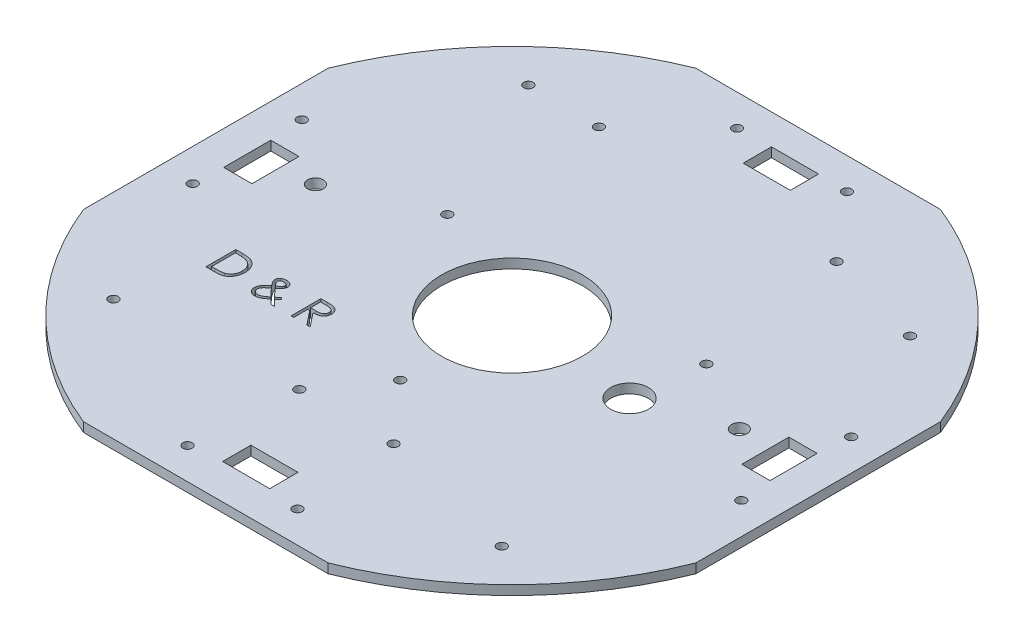
from build123d import *

# Parameters (mm, degrees)
SKETCH1_W                       = 195
SKETCH1_H                       = 195
PLATE_DEPTH                     = 3
SKETCH2_R                       = 177.836364648
SKETCH2_R_2                     = 105
OUTLINE_DEPTH                   = 30
SKETCH6_R                       = 22.448904698
MIDDLE_CIRCLE_DEPTH             = 145
PING_SENSOR_AND_ARDUINO_HOLES_R = 1.5
PING_AND_ARDUINO_DEPTH          = 30
STANDS_R                        = 1.5
STAND_DEPTH                     = 30
SKETCH8_R                       = 2.5
HANDLES_DEPTH                   = 30
SKETCH9_R                       = 1.5
COMPASS_DEPTH                   = 10
SKETCH10_R                      = 6
POWER_SUPPLY_DEPTH              = 10
CUT_EXTRUDE5_DEPTH              = 10
SKETCH14_W                      = 9
SKETCH14_H                      = 15
SKETCH14_W_2                    = 15
SKETCH14_H_2                    = 9
CUT_EXTRUDE6_DEPTH              = 10
SKETCH15_R                      = 1.5
CUT_EXTRUDE7_DEPTH              = 10


with BuildPart() as part:
    # Sketch1 → Plate (new body)
    with BuildSketch(Plane(origin=(0, 0, 0), x_dir=(1, 0, 0), z_dir=(0, 1, 0))):
        Rectangle(SKETCH1_W, SKETCH1_H)
    extrude(amount=PLATE_DEPTH)

    # Sketch2 → Outline (cut)
    with BuildSketch(Plane(origin=(0, 0, 0), x_dir=(1, 0, 0), z_dir=(0, 1, 0))):
        Circle(SKETCH2_R)
        Circle(SKETCH2_R_2, mode=Mode.SUBTRACT)
    extrude(amount=OUTLINE_DEPTH, mode=Mode.SUBTRACT)

    # Sketch6 → Middle Circle (cut)
    with BuildSketch(Plane(origin=(0, 0, 0), x_dir=(1, 0, 0), z_dir=(0, 1, 0))):
        with Locations(Location((0, 0, 0), (0, 0, 90))):
            Circle(SKETCH6_R)
    extrude(amount=MIDDLE_CIRCLE_DEPTH, mode=Mode.SUBTRACT)

    # Ping Sensor and Arduino Holes → Ping and Arduino (cut)
    with BuildSketch(Plane(origin=(0, 3, 0), x_dir=(1, 0, 0), z_dir=(0, 1, 0))):
        with Locations(Location((87.479634807, 20.549979122, 0), (0, 0, 270))):
            Circle(PING_SENSOR_AND_ARDUINO_HOLES_R)
        with Locations(Location((87.5, -14.450014953, 0), (0, 0, 270))):
            Circle(PING_SENSOR_AND_ARDUINO_HOLES_R)
        with Locations(Location((19.177133287, -87.5, 0), (0, 0, 270))):
            Circle(PING_SENSOR_AND_ARDUINO_HOLES_R)
        with Locations(Location((-15.822866713, -87.5, 0), (0, 0, 270))):
            Circle(PING_SENSOR_AND_ARDUINO_HOLES_R)
        with Locations(Location((-87.5, 20.549979122, 0), (0, 0, 270))):
            Circle(PING_SENSOR_AND_ARDUINO_HOLES_R)
        with Locations(Location((-87.240743574, -14.449060666, 0), (0, 0, 270))):
            Circle(PING_SENSOR_AND_ARDUINO_HOLES_R)
        with Locations(Location((-15.822866713, 87.5, 0), (0, 0, 270))):
            Circle(PING_SENSOR_AND_ARDUINO_HOLES_R)
        with Locations(Location((19.177133287, 87.5, 0), (0, 0, 270))):
            Circle(PING_SENSOR_AND_ARDUINO_HOLES_R)
        with Locations(Location((-38.186966972, 17.586762855, 0), (0, 0, 270))):
            Circle(PING_SENSOR_AND_ARDUINO_HOLES_R)
        with Locations(Location((44.313033028, 17.586762855, 0), (0, 0, 270))):
            Circle(PING_SENSOR_AND_ARDUINO_HOLES_R)
        with Locations(Location((-38.201988835, 65.886760519, 0), (0, 0, 270))):
            Circle(PING_SENSOR_AND_ARDUINO_HOLES_R)
        with Locations(Location((36.794744406, 66.586762855, 0), (0, 0, 270))):
            Circle(PING_SENSOR_AND_ARDUINO_HOLES_R)
    extrude(amount=-PING_AND_ARDUINO_DEPTH, mode=Mode.SUBTRACT)

    # Stands → Stand (cut)
    with BuildSketch(Plane(origin=(0, 3, 0), x_dir=(1, 0, 0), z_dir=(0, 1, 0))):
        with Locations(Location((61.994866731, -65.242903821, 0), (0, 0, 270))):
            Circle(STANDS_R)
        with Locations(Location((-68.005133269, -58.951690807, 0), (0, 0, 270))):
            Circle(STANDS_R)
        with Locations(Location((-60.977410647, 66.194829034, 0), (0, 0, 270))):
            Circle(STANDS_R)
        with Locations(Location((69.022589353, 57.757096179, 0), (0, 0, 270))):
            Circle(STANDS_R)
    extrude(amount=-STAND_DEPTH, mode=Mode.SUBTRACT)

    # Sketch8 → Handles (cut)
    with BuildSketch(Plane(origin=(0, 3, 0), x_dir=(1, 0, 0), z_dir=(0, 1, 0))):
        with Locations(Location((-67.5, 4.903874145, 0), (0, 0, 270))):
            Circle(SKETCH8_R)
        with Locations(Location((67.5, 4.903874145, 0), (0, 0, 270))):
            Circle(SKETCH8_R)
    extrude(amount=-HANDLES_DEPTH, mode=Mode.SUBTRACT)

    # Sketch9 → Compass (cut)
    with BuildSketch(Plane(origin=(0, 3, 0), x_dir=(1, 0, 0), z_dir=(0, 1, 0))):
        with Locations(Location((0, -35.600679942, 0), (0, 0, 270))):
            Circle(SKETCH9_R)
    extrude(amount=-COMPASS_DEPTH, mode=Mode.SUBTRACT)

    # Sketch10 → Power Supply (cut)
    with BuildSketch(Plane(origin=(0, 3, 0), x_dir=(1, 0, 0), z_dir=(0, 1, 0))):
        with Locations(Location((41.559592035, -4.12540068, 0), (0, 0, 270))):
            Circle(SKETCH10_R)
    extrude(amount=-POWER_SUPPLY_DEPTH, mode=Mode.SUBTRACT)

    # Sketch13 → Cut-Extrude5 (cut)
    # profile 1 of 3: a face of its own
    with BuildSketch(Plane(origin=(0, 3, 0), x_dir=(1, 0, 0), z_dir=(0, 1, 0))):
        with BuildLine():
            Line((-62.201246871, -35.295094706), (-62.201246871, -25.770094706))
            Line((-62.201246871, -25.770094706), (-60.277929563, -25.770094706))
            add(Edge.make_bspline(
                [(-60.277929563, -25.770094706), (-60.110646103, -25.771299129), (-59.787455327, -25.773626067), (-59.320424309, -25.788379996), (-58.888305642, -25.814479764), (-58.492520504, -25.852496831), (-58.131982348, -25.899177587), (-57.807700707, -25.957689402), (-57.517998804, -26.026781494), (-57.339828398, -26.085688041), (-57.255573794, -26.113544225)],
                knots=[0, 0, 0, 0, 1.314313732, 2.53924729, 3.670748893, 4.714932338, 5.66265055, 6.526160246, 7.303039223, 8, 8, 8, 8], degree=3))
            add(Edge.make_bspline(
                [(-57.255573794, -26.113544225), (-57.145370254, -26.155537789), (-56.927462223, -26.23857264), (-56.617199983, -26.395208003), (-56.325121673, -26.572680802), (-56.049661001, -26.771224971), (-55.79711018, -26.996462233), (-55.557602975, -27.238824731), (-55.340937191, -27.507125857), (-55.142522471, -27.79580136), (-54.96362757, -28.101450587), (-54.808127433, -28.423491133), (-54.67898478, -28.760287535), (-54.571778927, -29.110903188), (-54.487288211, -29.476109045), (-54.429643096, -29.856330352), (-54.391622045, -30.250064431), (-54.38780102, -30.517239222), (-54.385862256, -30.652802038)],
                knots=[0, 0, 0, 0, 0.984719456, 1.947108742, 2.898477687, 3.838006223, 4.779231079, 5.722358779, 6.681677486, 7.655904652, 8.64651281, 9.637519902, 10.640069247, 11.656948941, 12.698408672, 13.768548281, 14.867775369, 16, 16, 16, 16], degree=3))
            add(Edge.make_bspline(
                [(-54.385862256, -30.652802038), (-54.387573946, -30.770534408), (-54.39094701, -31.002538341), (-54.421234648, -31.344461064), (-54.465257348, -31.67624014), (-54.533413343, -31.996295653), (-54.616151612, -32.307431731), (-54.722189766, -32.606332339), (-54.843662081, -32.89573942), (-54.985312108, -33.171739837), (-55.140818305, -33.433223872), (-55.307701049, -33.679718702), (-55.485782342, -33.907706984), (-55.676760314, -34.117879135), (-55.878167028, -34.309918316), (-56.091321099, -34.48542873), (-56.316772545, -34.640976211), (-56.553511583, -34.782673127), (-56.808444478, -34.90628138), (-57.086399942, -35.010865907), (-57.388563362, -35.097534196), (-57.714193059, -35.169844991), (-58.063851666, -35.227205365), (-58.437881995, -35.265649333), (-58.835709376, -35.291646956), (-59.108884376, -35.293923141), (-59.249489059, -35.295094706)],
                knots=[0, 0, 0, 0, 1.105936401, 2.179363191, 3.223086493, 4.248585256, 5.251745608, 6.245858792, 7.225916811, 8.198733463, 9.158002045, 10.082870192, 10.993790845, 11.873723703, 12.748670949, 13.606408763, 14.465103618, 15.319838547, 16.196477973, 17.123216899, 18.106603292, 19.147568657, 20.255746949, 21.433717677, 22.679120308, 24, 24, 24, 24], degree=3))
            Line((-59.249489059, -35.295094706), (-62.201246871, -35.295094706))
        make_face()
        with BuildLine():
            Line((-61.346439179, -34.318171629), (-60.253124876, -34.318171629))
            add(Edge.make_bspline(
                [(-60.253124876, -34.318171629), (-60.096021238, -34.317496453), (-59.793853408, -34.316197841), (-59.359355573, -34.304802667), (-58.962355215, -34.286182822), (-58.602795965, -34.260124932), (-58.280880834, -34.225648201), (-57.995937058, -34.187208287), (-57.748898676, -34.139318082), (-57.599412137, -34.095908685), (-57.53033341, -34.075848913)],
                knots=[0, 0, 0, 0, 1.375205317, 2.645023457, 3.804390687, 4.853969522, 5.800190428, 6.637939096, 7.370582563, 8, 8, 8, 8], degree=3))
            add(Edge.make_bspline(
                [(-57.53033341, -34.075848913), (-57.443388224, -34.045228601), (-57.271574537, -33.984719342), (-57.024248156, -33.874344564), (-56.793588021, -33.743601503), (-56.57557431, -33.598271029), (-56.373299626, -33.433227266), (-56.184366852, -33.252059075), (-56.009156379, -33.053844437), (-55.849478441, -32.838829369), (-55.706580842, -32.60835214), (-55.582834139, -32.364678599), (-55.474381042, -32.110478637), (-55.389258587, -31.841848713), (-55.322541175, -31.561190346), (-55.275284417, -31.268483795), (-55.245852917, -30.96378372), (-55.242419977, -30.756541154), (-55.240669948, -30.650893985)],
                knots=[0, 0, 0, 0, 0.998632004, 1.973411704, 2.929992603, 3.868527914, 4.809262121, 5.754881198, 6.702106254, 7.672490631, 8.653608572, 9.636854334, 10.631411391, 11.644891563, 12.686317036, 13.754757253, 14.855430412, 16, 16, 16, 16], degree=3))
            add(Edge.make_bspline(
                [(-55.240669948, -30.650893985), (-55.242066823, -30.539496442), (-55.244810996, -30.320654983), (-55.279303227, -29.999551734), (-55.329708317, -29.690722249), (-55.402598205, -29.394145875), (-55.495482954, -29.109244002), (-55.611401229, -28.837592335), (-55.743843957, -28.576321942), (-55.901423753, -28.331463132), (-56.07400476, -28.099888314), (-56.265533132, -27.887739579), (-56.472965965, -27.694533662), (-56.694040806, -27.517261676), (-56.934988197, -27.363055529), (-57.19013217, -27.225115347), (-57.463215747, -27.108050671), (-57.653206012, -27.04578748), (-57.749759491, -27.014145187)],
                knots=[0, 0, 0, 0, 1.122418816, 2.205001699, 3.251619955, 4.274784885, 5.280384055, 6.268708349, 7.249350384, 8.229342522, 9.199999885, 10.157847722, 11.105861043, 12.055065948, 13.010012805, 13.98527497, 14.976112212, 16, 16, 16, 16], degree=3))
            add(Edge.make_bspline(
                [(-57.749759491, -27.014145187), (-57.82963654, -26.992056908), (-57.99947706, -26.945091167), (-58.276625887, -26.893859261), (-58.58854283, -26.848671303), (-58.936612731, -26.810413353), (-59.320438823, -26.782961428), (-59.740316302, -26.762356636), (-60.196426655, -26.748459301), (-60.512609122, -26.747510319), (-60.676712616, -26.747017783)],
                knots=[0, 0, 0, 0, 0.674548936, 1.434276114, 2.292660221, 3.240891867, 4.284742987, 5.42552168, 6.663806718, 8, 8, 8, 8], degree=3))
            Line((-60.676712616, -26.747017783), (-61.346439179, -26.747017783))
            Line((-61.346439179, -26.747017783), (-61.346439179, -34.318171629))
        make_face(mode=Mode.SUBTRACT)
    # profile 2 of 3: a face of its own
    with BuildSketch(Plane(origin=(0, 3, 0), x_dir=(1, 0, 0), z_dir=(0, 1, 0))):
        with BuildLine():
            Line((-41.66868978, -31.753748552), (-41.128710813, -32.379589898))
            add(Edge.make_bspline(
                [(-41.128710813, -32.379589898), (-41.230492582, -32.462248875), (-41.4308949, -32.62499954), (-41.725043756, -32.864545029), (-42.008838915, -33.093839972), (-42.192845781, -33.244478657), (-42.283082809, -33.318351918)],
                knots=[0, 0, 0, 0, 1.057475972, 2.082108015, 3.059465138, 4, 4, 4, 4], degree=3))
            add(Edge.make_bspline(
                [(-42.283082809, -33.318351918), (-42.203491251, -33.399038444), (-42.037673015, -33.567137897), (-41.780813785, -33.831152551), (-41.501460174, -34.112790752), (-41.309861113, -34.30851856), (-41.210757087, -34.409758168)],
                knots=[0, 0, 0, 0, 0.888881212, 1.851863672, 2.888883089, 4, 4, 4, 4], degree=3))
            add(Edge.make_bspline(
                [(-41.210757087, -34.409758168), (-41.131874656, -34.489880463), (-40.978526918, -34.645638501), (-40.754769042, -34.873450459), (-40.543534505, -35.087728455), (-40.408009995, -35.227586137), (-40.342593025, -35.295094706)],
                knots=[0, 0, 0, 0, 1.088118532, 2.115306442, 3.090268309, 4, 4, 4, 4], degree=3))
            Line((-40.342593025, -35.295094706), (-41.491240862, -35.295094706))
            Line((-41.491240862, -35.295094706), (-42.922280525, -33.837342302))
            add(Edge.make_bspline(
                [(-42.922280525, -33.837342302), (-43.024292807, -33.919879419), (-43.221152187, -34.079156375), (-43.512580202, -34.301942571), (-43.784069983, -34.506741352), (-44.039652862, -34.688391423), (-44.279452564, -34.847252901), (-44.500867273, -34.986422561), (-44.706184108, -35.104144193), (-44.955792648, -35.231000741), (-45.263951329, -35.354236668), (-45.639391358, -35.462609574), (-46.026342594, -35.527411417), (-46.287844727, -35.535330991), (-46.419741462, -35.539325475)],
                knots=[0, 0, 0, 0, 1.188070381, 2.29269255, 3.321212884, 4.267145447, 5.131232476, 5.925402657, 6.634692834, 7.273399376, 8.459346405, 9.633235643, 10.80624877, 12, 12, 12, 12], degree=3))
            add(Edge.make_bspline(
                [(-46.419741462, -35.539325475), (-46.506344363, -35.537777028), (-46.675666215, -35.534749577), (-46.922606703, -35.502819411), (-47.156788135, -35.454394351), (-47.377146467, -35.383232576), (-47.584609754, -35.292746336), (-47.780362819, -35.184875008), (-47.961107285, -35.052852108), (-48.12798112, -34.903244369), (-48.277260457, -34.738166553), (-48.409000371, -34.56295672), (-48.520141662, -34.376781851), (-48.61156743, -34.180524484), (-48.683091213, -33.974734386), (-48.731973293, -33.759033902), (-48.763842289, -33.53364438), (-48.766966511, -33.379520904), (-48.768554563, -33.301179442)],
                knots=[0, 0, 0, 0, 1.140827302, 2.230491023, 3.276155818, 4.288841946, 5.276195931, 6.25568983, 7.228235982, 8.219567526, 9.204677076, 10.15696153, 11.104363201, 12.056942777, 13.006011855, 13.969848463, 14.968067402, 16, 16, 16, 16], degree=3))
            add(Edge.make_bspline(
                [(-48.768554563, -33.301179442), (-48.762654978, -33.179907331), (-48.750755556, -32.935302384), (-48.664595526, -32.569188973), (-48.52215275, -32.205851277), (-48.363347041, -31.902293408), (-48.196352296, -31.657721443), (-48.044469312, -31.456440636), (-47.858050465, -31.247486338), (-47.648109118, -31.022221227), (-47.405537737, -30.788098472), (-47.136951654, -30.540044698), (-46.839049595, -30.280581097), (-46.628164546, -30.107202491), (-46.518960212, -30.017420427)],
                knots=[0, 0, 0, 0, 1.059627018, 2.137259838, 3.268884587, 4.465199172, 5.122089581, 5.855989104, 6.667703162, 7.568389345, 8.547351898, 9.613609101, 10.764235646, 12, 12, 12, 12], degree=3))
            add(Edge.make_bspline(
                [(-46.518960212, -30.017420427), (-46.577719411, -29.943197708), (-46.690565463, -29.800654224), (-46.848934084, -29.592627738), (-46.991000597, -29.399388975), (-47.115832299, -29.220490779), (-47.227361027, -29.058656089), (-47.322020681, -28.911636225), (-47.397362353, -28.778272483), (-47.479363278, -28.625009594), (-47.55479793, -28.443249935), (-47.620893129, -28.230688304), (-47.660986407, -28.022467481), (-47.666704676, -27.885014936), (-47.669516102, -27.817435451)],
                knots=[0, 0, 0, 0, 1.347531222, 2.587911062, 3.721495934, 4.761363145, 5.693007242, 6.519321152, 7.249247836, 7.872897469, 8.99276919, 10.043809027, 11.038225309, 12, 12, 12, 12], degree=3))
            add(Edge.make_bspline(
                [(-47.669516102, -27.817435451), (-47.668462112, -27.760703807), (-47.66638897, -27.649115625), (-47.637744052, -27.486242889), (-47.596112811, -27.329990468), (-47.537492929, -27.180859016), (-47.458995742, -27.040779285), (-47.368466963, -26.905605257), (-47.255754867, -26.781673532), (-47.172149141, -26.705634825), (-47.129537136, -26.666879562)],
                knots=[0, 0, 0, 0, 1.03459038, 2.034985263, 3.00970721, 3.984429156, 4.951093115, 5.936753036, 6.948408246, 8, 8, 8, 8], degree=3))
            add(Edge.make_bspline(
                [(-47.129537136, -26.666879562), (-47.076807776, -26.624624429), (-46.971609115, -26.540322562), (-46.801321005, -26.430226494), (-46.61842602, -26.342662211), (-46.429822558, -26.263762474), (-46.22953673, -26.208031348), (-46.021179816, -26.165450169), (-45.802787992, -26.140252809), (-45.654040661, -26.137727096), (-45.57829014, -26.13644086)],
                knots=[0, 0, 0, 0, 0.967861857, 1.93095028, 2.896793832, 3.869789818, 4.856135748, 5.869432465, 6.914994986, 8, 8, 8, 8], degree=3))
            add(Edge.make_bspline(
                [(-45.57829014, -26.13644086), (-45.482725486, -26.139470787), (-45.29438776, -26.145442131), (-45.018830376, -26.189711188), (-44.756086168, -26.264554068), (-44.510508565, -26.369704762), (-44.28246727, -26.495410691), (-44.083150052, -26.647605084), (-43.91025709, -26.818475594), (-43.769866718, -27.010332205), (-43.657439924, -27.21299974), (-43.575636461, -27.423941725), (-43.525938099, -27.641479886), (-43.520379054, -27.789197183), (-43.517593025, -27.863228721)],
                knots=[0, 0, 0, 0, 1.150236937, 2.266873792, 3.350248666, 4.431131026, 5.476858895, 6.476929332, 7.440723444, 8.393319161, 9.328959997, 10.223430523, 11.109635963, 12, 12, 12, 12], degree=3))
            add(Edge.make_bspline(
                [(-43.517593025, -27.863228721), (-43.521620237, -27.94380509), (-43.529964913, -28.110765208), (-43.602436865, -28.361715989), (-43.712862015, -28.620673763), (-43.840845332, -28.838631646), (-43.969981351, -29.019568583), (-44.090066619, -29.167723111), (-44.230609139, -29.325153758), (-44.394500493, -29.491637755), (-44.578507933, -29.66775408), (-44.783764716, -29.853831838), (-45.01081885, -30.047862292), (-45.17097574, -30.178651114), (-45.25392115, -30.246386773)],
                knots=[0, 0, 0, 0, 0.95228837, 1.973211012, 3.069609294, 4.280899273, 4.9557195, 5.700045445, 6.53727831, 7.453060125, 8.46483533, 9.552225843, 10.73229536, 12, 12, 12, 12], degree=3))
            Line((-45.25392115, -30.246386773), (-43.819065381, -31.753748552))
            Line((-43.819065381, -31.753748552), (-42.865038938, -32.726855523))
            add(Edge.make_bspline(
                [(-42.865038938, -32.726855523), (-42.749950881, -32.633322721), (-42.529950016, -32.454526607), (-42.215106545, -32.199646179), (-41.932482342, -31.96749584), (-41.753352551, -31.822349568), (-41.66868978, -31.753748552)],
                knots=[0, 0, 0, 0, 1.154001856, 2.20597526, 3.152083497, 4, 4, 4, 4], degree=3))
        make_face()
        with BuildLine():
            add(Edge.make_bspline(
                [(-45.839693386, -29.538499153), (-45.714992294, -29.454416717), (-45.476909529, -29.293884209), (-45.156709055, -29.036259281), (-44.878321758, -28.787304952), (-44.725528842, -28.607157055), (-44.652884491, -28.521506966)],
                knots=[0, 0, 0, 0, 1.149778042, 2.195187973, 3.141914424, 4, 4, 4, 4], degree=3))
            add(Edge.make_bspline(
                [(-44.652884491, -28.521506966), (-44.610486819, -28.465329362), (-44.530646269, -28.359539337), (-44.443891199, -28.195231947), (-44.383111106, -28.041664944), (-44.375845041, -27.940028237), (-44.372400717, -27.891849514)],
                knots=[0, 0, 0, 0, 1.202613574, 2.264683996, 3.177410281, 4, 4, 4, 4], degree=3))
            add(Edge.make_bspline(
                [(-44.372400717, -27.891849514), (-44.376448711, -27.840321669), (-44.384604166, -27.736509014), (-44.452723532, -27.588163249), (-44.564102952, -27.454886083), (-44.713971468, -27.33627932), (-44.896545375, -27.235572922), (-45.110102845, -27.162895139), (-45.351588026, -27.122087976), (-45.521525745, -27.116366941), (-45.610727039, -27.113363937)],
                knots=[0, 0, 0, 0, 0.764515178, 1.54026142, 2.381579227, 3.330821025, 4.368998387, 5.470797668, 6.672407028, 8, 8, 8, 8], degree=3))
            add(Edge.make_bspline(
                [(-45.610727039, -27.113363937), (-45.69549784, -27.116270787), (-45.858630223, -27.12186471), (-46.0913243, -27.164940834), (-46.299304465, -27.240368872), (-46.479679784, -27.341876383), (-46.62687402, -27.463853926), (-46.734793006, -27.601246249), (-46.802610681, -27.751858451), (-46.810692643, -27.858127213), (-46.81470841, -27.910930043)],
                knots=[0, 0, 0, 0, 1.27617104, 2.455855338, 3.546649981, 4.593280411, 5.55842324, 6.40519289, 7.207572142, 8, 8, 8, 8], degree=3))
            add(Edge.make_bspline(
                [(-46.81470841, -27.910930043), (-46.813184194, -27.951725793), (-46.810135578, -28.033322254), (-46.787269772, -28.153734084), (-46.746339659, -28.269339889), (-46.709317162, -28.341890628), (-46.690684972, -28.378402999)],
                knots=[0, 0, 0, 0, 1.001046439, 2.002214593, 2.994581098, 4, 4, 4, 4], degree=3))
            add(Edge.make_bspline(
                [(-46.690684972, -28.378402999), (-46.636508453, -28.469463359), (-46.523219143, -28.659881011), (-46.322662848, -28.941875939), (-46.09561124, -29.239676168), (-45.927220914, -29.436297463), (-45.839693386, -29.538499153)],
                knots=[0, 0, 0, 0, 0.882093017, 1.844557613, 2.879623611, 4, 4, 4, 4], degree=3))
        make_face(mode=Mode.SUBTRACT)
        with BuildLine():
            add(Edge.make_bspline(
                [(-45.895026919, -30.732940259), (-45.994618374, -30.80878663), (-46.186354866, -30.954808367), (-46.456542231, -31.172741393), (-46.702521344, -31.376265287), (-46.91918898, -31.570820016), (-47.110331674, -31.751885328), (-47.27636222, -31.919574217), (-47.413415181, -32.077490121), (-47.558273806, -32.265858045), (-47.696582129, -32.491845052), (-47.819259829, -32.756381914), (-47.897427048, -33.012485152), (-47.908454222, -33.181768456), (-47.913746871, -33.263018384)],
                knots=[0, 0, 0, 0, 1.348995177, 2.597126469, 3.74061818, 4.789100084, 5.734499531, 6.577865258, 7.330979068, 7.986257854, 9.13712093, 10.176896549, 11.124975592, 12, 12, 12, 12], degree=3))
            add(Edge.make_bspline(
                [(-47.913746871, -33.263018384), (-47.912086487, -33.308874961), (-47.908771797, -33.400420255), (-47.888084103, -33.535735977), (-47.85079619, -33.66648549), (-47.801360848, -33.79357936), (-47.735685088, -33.916252922), (-47.655566003, -34.034424549), (-47.560225806, -34.147434445), (-47.455232332, -34.257409905), (-47.338323301, -34.358163152), (-47.210958279, -34.443560853), (-47.079402119, -34.518559883), (-46.941225946, -34.580950253), (-46.795211138, -34.625184312), (-46.644461187, -34.66101413), (-46.48632638, -34.679261472), (-46.379073313, -34.682741711), (-46.324338818, -34.684517783)],
                knots=[0, 0, 0, 0, 0.93114453, 1.858880562, 2.770572272, 3.686551743, 4.622340414, 5.589324723, 6.57965016, 7.620701392, 8.673933733, 9.705411322, 10.728856044, 11.746254978, 12.775385999, 13.821629539, 14.888311458, 16, 16, 16, 16], degree=3))
            add(Edge.make_bspline(
                [(-46.324338818, -34.684517783), (-46.24019261, -34.682129978), (-46.071487051, -34.677342644), (-45.821008572, -34.632662319), (-45.572060182, -34.565332656), (-45.412874152, -34.497554022), (-45.332151318, -34.463183648)],
                knots=[0, 0, 0, 0, 0.985107723, 1.975052154, 2.97315407, 4, 4, 4, 4], degree=3))
            add(Edge.make_bspline(
                [(-45.332151318, -34.463183648), (-45.266242714, -34.432159424), (-45.12999656, -34.3680262), (-44.926077714, -34.252813046), (-44.71026854, -34.126554447), (-44.487512403, -33.980094099), (-44.254648795, -33.819828368), (-44.01185263, -33.644126097), (-43.760489759, -33.451246327), (-43.591120643, -33.315488021), (-43.504236655, -33.245845908)],
                knots=[0, 0, 0, 0, 0.793866152, 1.641078755, 2.55195156, 3.519315084, 4.546339611, 5.633686856, 6.786114446, 8, 8, 8, 8], degree=3))
            Line((-43.504236655, -33.245845908), (-45.032587015, -31.686966701))
            add(Edge.make_bspline(
                [(-45.032587015, -31.686966701), (-45.098996971, -31.61661251), (-45.236802039, -31.47062289), (-45.445062767, -31.239512313), (-45.66788144, -30.993418028), (-45.817714752, -30.821597541), (-45.895026919, -30.732940259)],
                knots=[0, 0, 0, 0, 0.902632658, 1.873022723, 2.90250559, 4, 4, 4, 4], degree=3))
        make_face(mode=Mode.SUBTRACT)
    # profile 3 of 3: a face of its own
    with BuildSketch(Plane(origin=(0, 3, 0), x_dir=(1, 0, 0), z_dir=(0, 1, 0))):
        with BuildLine():
            Line((-35.091631487, -25.770094706), (-33.185486655, -25.770094706))
            add(Edge.make_bspline(
                [(-33.185486655, -25.770094706), (-33.058284012, -25.770518122), (-32.814040848, -25.771331128), (-32.464137876, -25.775864383), (-32.146201277, -25.788857451), (-31.860397285, -25.800038668), (-31.606731146, -25.820427451), (-31.384425019, -25.83991464), (-31.194502785, -25.865424389), (-31.079533718, -25.889115575), (-31.027478842, -25.899842302)],
                knots=[0, 0, 0, 0, 1.410062039, 2.707475311, 3.878576406, 4.937260626, 5.877586885, 6.699081471, 7.410979367, 8, 8, 8, 8], degree=3))
            add(Edge.make_bspline(
                [(-31.027478842, -25.899842302), (-30.957792244, -25.917060142), (-30.819905651, -25.951128519), (-30.621377257, -26.023136433), (-30.43219899, -26.106465554), (-30.253156682, -26.20433825), (-30.085147136, -26.317481043), (-29.926438019, -26.443940719), (-29.776309151, -26.583025329), (-29.640832, -26.738241577), (-29.513090723, -26.901082364), (-29.405353104, -27.077169016), (-29.312480327, -27.26130503), (-29.238537706, -27.455363074), (-29.178998364, -27.657461182), (-29.137016955, -27.869429979), (-29.111840509, -28.090303775), (-29.109277316, -28.24095637), (-29.10797764, -28.317345307)],
                knots=[0, 0, 0, 0, 1.027469482, 2.033020251, 3.019912614, 3.986113645, 4.951240523, 5.91722682, 6.890402269, 7.87763091, 8.8651537, 9.85103654, 10.82876324, 11.815024772, 12.821070561, 13.842952187, 14.906261191, 16, 16, 16, 16], degree=3))
            add(Edge.make_bspline(
                [(-29.10797764, -28.317345307), (-29.111975414, -28.444259413), (-29.119776105, -28.691901706), (-29.192506566, -29.051295962), (-29.311641237, -29.386546882), (-29.47580676, -29.697232347), (-29.684865476, -29.977296317), (-29.9361208, -30.223287485), (-30.2297129, -30.429136104), (-30.50302411, -30.571882666), (-30.744453468, -30.663303367), (-30.943208412, -30.727628029), (-31.1600164, -30.777326663), (-31.392800147, -30.821849593), (-31.642528381, -30.855463848), (-31.908602559, -30.880083508), (-32.191212443, -30.895470598), (-32.385356625, -30.897762054), (-32.485231246, -30.89894086)],
                knots=[0, 0, 0, 0, 1.260483769, 2.459530307, 3.627416485, 4.787058657, 5.939039949, 7.08810263, 8.267026773, 9.491475466, 10.141966685, 10.831826277, 11.566392101, 12.351337768, 13.187381173, 14.07005841, 15.007169909, 16, 16, 16, 16], degree=3))
            Line((-32.485231246, -30.89894086), (-28.985862256, -35.295094706))
            Line((-28.985862256, -35.295094706), (-30.042923554, -35.295094706))
            Line((-30.042923554, -35.295094706), (-33.542292544, -30.89894086))
            Line((-33.542292544, -30.89894086), (-34.236823794, -30.89894086))
            Line((-34.236823794, -30.89894086), (-34.236823794, -35.295094706))
            Line((-34.236823794, -35.295094706), (-35.091631487, -35.295094706))
            Line((-35.091631487, -35.295094706), (-35.091631487, -25.770094706))
        make_face()
        with BuildLine():
            Line((-34.236823794, -26.747017783), (-34.236823794, -29.922017783))
            Line((-34.236823794, -29.922017783), (-32.492863458, -29.935374153))
            add(Edge.make_bspline(
                [(-32.492863458, -29.935374153), (-32.411438209, -29.935410176), (-32.253612886, -29.935479998), (-32.025283219, -29.924611221), (-31.812684915, -29.912246905), (-31.616631154, -29.893334758), (-31.437034353, -29.868961448), (-31.273984278, -29.838473327), (-31.127214773, -29.802953071), (-30.956040893, -29.747975789), (-30.76489719, -29.660873696), (-30.557166574, -29.534149018), (-30.380267355, -29.374757343), (-30.230812315, -29.192493867), (-30.11071722, -28.992098075), (-30.026047986, -28.775972099), (-29.972320339, -28.549572107), (-29.965983369, -28.393965971), (-29.962785333, -28.315437254)],
                knots=[0, 0, 0, 0, 1.146690395, 2.22261258, 3.21895312, 4.145990853, 4.996080663, 5.770904154, 6.481378293, 7.121626537, 8.300444488, 9.431385265, 10.535395872, 11.636531494, 12.74115979, 13.810798291, 14.895190096, 16, 16, 16, 16], degree=3))
            add(Edge.make_bspline(
                [(-29.962785333, -28.315437254), (-29.966056819, -28.238838364), (-29.972539712, -28.087047315), (-30.025468147, -27.864826587), (-30.114974249, -27.655094387), (-30.235594053, -27.458703896), (-30.382548896, -27.280434715), (-30.554863801, -27.127906391), (-30.747827225, -27.002041777), (-30.928179558, -26.921611641), (-31.089381236, -26.872299755), (-31.229343382, -26.837598373), (-31.387489618, -26.809718783), (-31.56458783, -26.787381132), (-31.759881983, -26.768181605), (-31.97435954, -26.755249979), (-32.206597492, -26.747592248), (-32.367561641, -26.747213728), (-32.450886294, -26.747017783)],
                knots=[0, 0, 0, 0, 1.101028733, 2.181837193, 3.264309656, 4.369019818, 5.486613113, 6.575447106, 7.666700264, 8.788928104, 9.402425223, 10.0903467, 10.862060571, 11.710948788, 12.657782767, 13.684531032, 14.801375019, 16, 16, 16, 16], degree=3))
            Line((-32.450886294, -26.747017783), (-34.236823794, -26.747017783))
        make_face(mode=Mode.SUBTRACT)
    extrude(amount=-CUT_EXTRUDE5_DEPTH, mode=Mode.SUBTRACT)


with BuildPart() as cut_extrude5_piece_1:
    # of the separate pieces the step leaves, piece 1, a body of its own (cut_extrude5_pieces)
    add(part.part.solids().sort_by_distance((-38.97114317, 0, 97.5))[0])

    # Sketch14 → Cut-Extrude6 (cut)
    with BuildSketch(Plane(origin=(0, 3, 0), x_dir=(1, 0, 0), z_dir=(0, 1, 0))):
        with Locations((-82.286206897, 2.457843613)):
            Rectangle(SKETCH14_W, SKETCH14_H)
        with Locations((1.667557067, -81.827829043)):
            Rectangle(SKETCH14_W_2, SKETCH14_H_2)
        with Locations((82.11864983, 3.069014085)):
            Rectangle(SKETCH14_W, SKETCH14_H)
        with Locations((2.278727538, 83.355755221)):
            Rectangle(SKETCH14_W_2, SKETCH14_H_2)
    extrude(amount=-CUT_EXTRUDE6_DEPTH, mode=Mode.SUBTRACT)

    # Sketch15 → Cut-Extrude7 (cut)
    with BuildSketch(Plane(origin=(0, 3, 0), x_dir=(1, 0, 0), z_dir=(0, 1, 0))):
        with Locations(Location((-13.498384971, -54.241980646, 0), (0, 0, 270))):
            Circle(SKETCH15_R)
        with Locations(Location((16.50160272, -54.214803911, 0), (0, 0, 270))):
            Circle(SKETCH15_R)
    extrude(amount=-CUT_EXTRUDE7_DEPTH, mode=Mode.SUBTRACT)


with BuildPart() as cut_extrude5_piece_2:
    # of the separate pieces the step leaves, piece 2, a body of its own (cut_extrude5_pieces)
    add(part.part.solids().sort_by_distance((-61.346439179, 0, 26.747017783))[0])


with BuildPart() as cut_extrude5_piece_3:
    # of the separate pieces the step leaves, piece 3, a body of its own (cut_extrude5_pieces)
    add(part.part.solids().sort_by_distance((-32.450886294, 0, 26.747017783))[0])


with BuildPart() as cut_extrude5_piece_4:
    # of the separate pieces the step leaves, piece 4, a body of its own (cut_extrude5_pieces)
    add(part.part.solids().sort_by_distance((-47.913746871, 0, 33.263018384))[0])


with BuildPart() as cut_extrude5_piece_5:
    # of the separate pieces the step leaves, piece 5, a body of its own (cut_extrude5_pieces)
    add(part.part.solids().sort_by_distance((-44.652884491, 0, 28.521506966))[0])


solid = Compound([cut_extrude5_piece_1.part, cut_extrude5_piece_2.part, cut_extrude5_piece_3.part, cut_extrude5_piece_4.part, cut_extrude5_piece_5.part])
